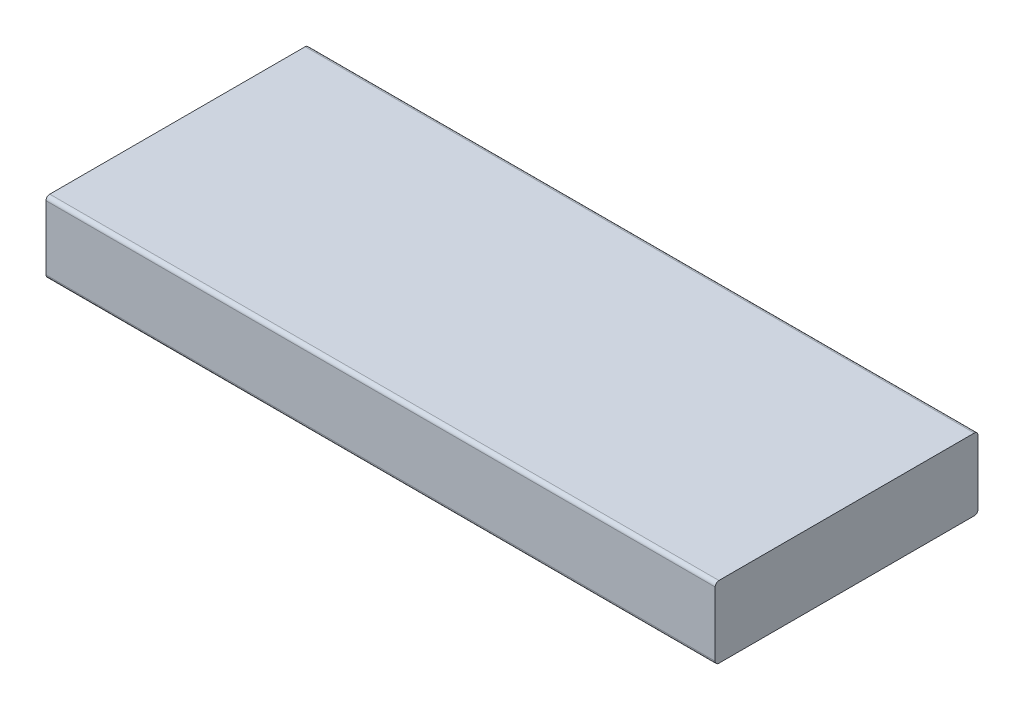
from build123d import *

# Parameters (mm, degrees)
SKETCH1_W           = 139.7
SKETCH1_H           = 38.1
BOSS_EXTRUDE1_DEPTH = 355.6
FILLET1_R           = 2


with BuildPart() as part:
    # Sketch1 → Boss-Extrude1 (new body)
    with BuildSketch(Plane(origin=(0, 0, 0), x_dir=(0, 0, -1), z_dir=(1, 0, 0))):
        Rectangle(SKETCH1_W, SKETCH1_H)
    extrude(amount=BOSS_EXTRUDE1_DEPTH)

    # Fillet1
    fillet1_edges = [part.edges().sort_by_distance(p)[0] for p in [
        (177.8, -19.05, -69.85),
        (177.8, -19.05, 69.85),
        (177.8, 19.05, 69.85),
        (177.8, 19.05, -69.85),
    ]]
    fillet(fillet1_edges, radius=FILLET1_R)


solid = part.part
